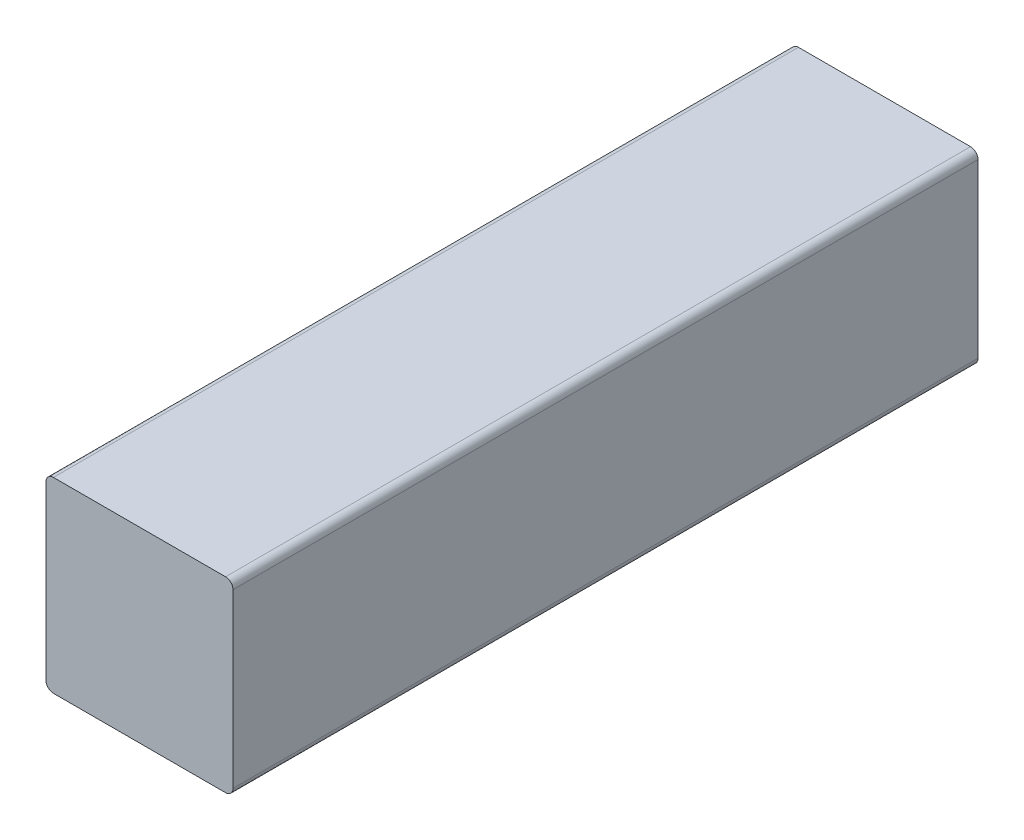
from build123d import *

# Parameters (mm, degrees)
BOSS_EXTRUDE1_DEPTH = 25.4


with BuildPart() as part:
    # Sketch1 → Boss-Extrude1 (new body)
    with BuildSketch(Plane.XY):
        with BuildLine():
            Line((0.254, 0), (6.1214, 0))
            ThreePointArc((6.1214, 0), (6.301005122, 0.074394878), (6.3754, 0.254))
            Line((6.3754, 0.254), (6.3754, 6.1214))
            ThreePointArc((6.3754, 6.1214), (6.301005122, 6.301005122), (6.1214, 6.3754))
            Line((6.1214, 6.3754), (0.254, 6.3754))
            ThreePointArc((0.254, 6.3754), (0.074394878, 6.301005122), (0, 6.1214))
            Line((0, 6.1214), (0, 0.254))
            ThreePointArc((0, 0.254), (0.074394878, 0.074394878), (0.254, 0))
        make_face()
    extrude(amount=BOSS_EXTRUDE1_DEPTH)


solid = part.part
